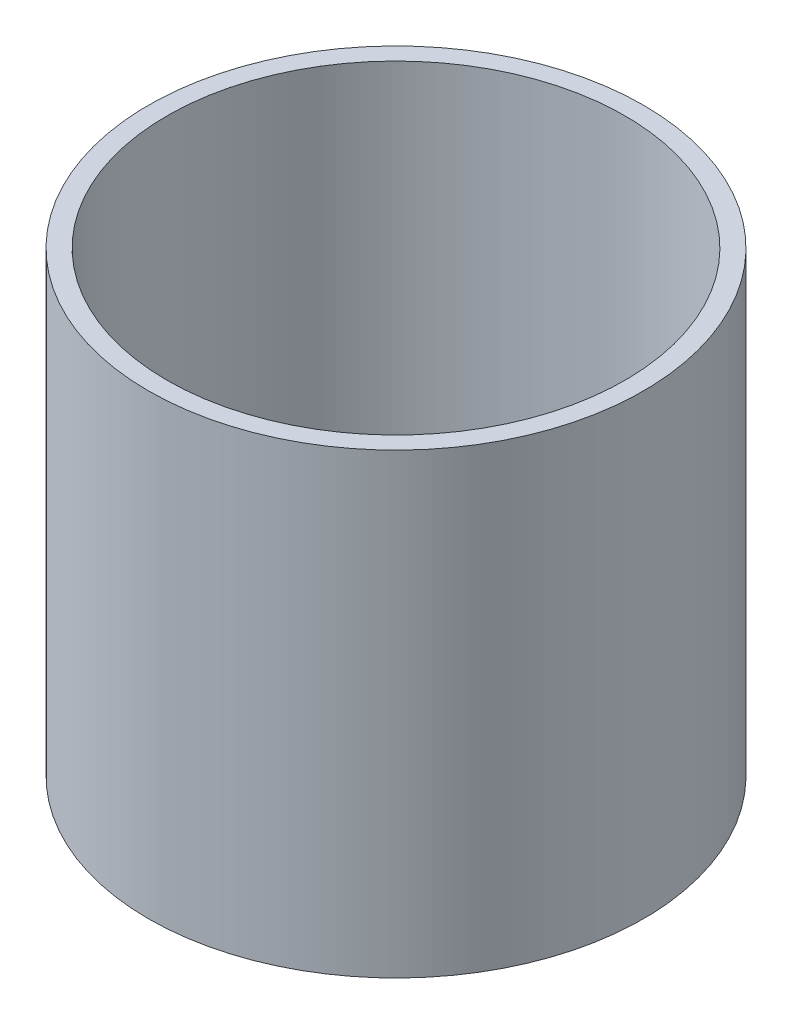
from build123d import *

# Parameters (mm, degrees)
SKETCH1_R           = 27.5
SKETCH1_R_2         = 25.45
BOSS_EXTRUDE1_DEPTH = 50.8


with BuildPart() as part:
    # Sketch1 → Boss-Extrude1 (new body)
    with BuildSketch(Plane(origin=(0, 0, 0), x_dir=(1, 0, 0), z_dir=(0, 1, 0))):
        with Locations(Location((0, 0, 0), (0, 0, 270))):
            Circle(SKETCH1_R)
        with Locations(Location((0, 0, 0), (0, 0, 270))):
            Circle(SKETCH1_R_2, mode=Mode.SUBTRACT)
    extrude(amount=BOSS_EXTRUDE1_DEPTH)


solid = part.part
